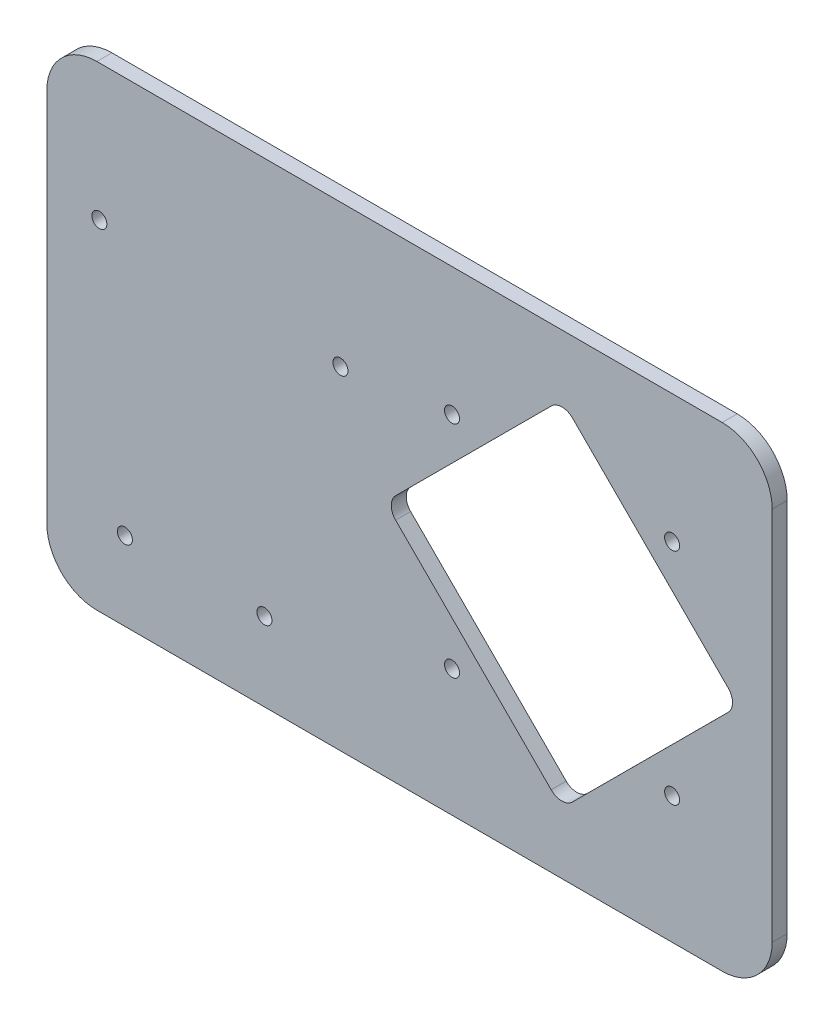
from build123d import *

# Parameters (mm, degrees)
SKETCH_1_R      = 1.5
EXTRUDE_1_DEPTH = 3


with BuildPart() as part:
    # 草图1 → 凸台-拉伸1 (new body)
    with BuildSketch(Plane(origin=(0, 0, 0), x_dir=(-1, 0, 0), z_dir=(0, 0, -1))):
        with BuildLine():
            Line((-108.521309774, 0), (16.478690226, 0))
            ThreePointArc((16.478690226, 0), (23.549758037, 2.928932188), (26.478690226, 10))
            Line((26.478690226, 10), (26.478690226, 84.99928))
            ThreePointArc((26.478690226, 84.99928), (23.549758037, 92.070347812), (16.478690226, 94.99928))
            Line((16.478690226, 94.99928), (-108.521309774, 94.99928))
            ThreePointArc((-108.521309774, 94.99928), (-115.592377586, 92.070347812), (-118.521309774, 84.99928))
            Line((-118.521309774, 84.99928), (-118.521309774, 10))
            ThreePointArc((-118.521309774, 10), (-115.592377586, 2.928932188), (-108.521309774, 0))
        make_face()
        with Locations(Location((15.978690226, 67.81454533, 0), (0, 0, 180))):
            Circle(SKETCH_1_R, mode=Mode.SUBTRACT)
        with Locations(Location((-32.220309774, 66.51524533, 0), (0, 0, 180))):
            Circle(SKETCH_1_R, mode=Mode.SUBTRACT)
        with Locations(Location((10.878690226, 15.71504533, 0), (0, 0, 180))):
            Circle(SKETCH_1_R, mode=Mode.SUBTRACT)
        with Locations(Location((-54.521309774, 69.37594533, 0), (0, 0, 180))):
            Circle(SKETCH_1_R, mode=Mode.SUBTRACT)
        with Locations(Location((-98.520309774, 69.37594533, 0), (0, 0, 180))):
            Circle(SKETCH_1_R, mode=Mode.SUBTRACT)
        with Locations(Location((-98.520309774, 25.37514533, 0), (0, 0, 180))):
            Circle(SKETCH_1_R, mode=Mode.SUBTRACT)
        with Locations(Location((-54.521309774, 25.37514533, 0), (0, 0, 180))):
            Circle(SKETCH_1_R, mode=Mode.SUBTRACT)
        with Locations(Location((-17.021309774, 15.71504533, 0), (0, 0, 180))):
            Circle(SKETCH_1_R, mode=Mode.SUBTRACT)
        with BuildLine():
            Line((-109.719554185, 49.655521805), (-78.625612362, 80.786563559))
            ThreePointArc((-78.625612362, 80.786563559), (-76.504816284, 81.666507838), (-74.382972429, 80.789093116))
            Line((-74.382972429, 80.789093116), (-43.251668672, 49.694889603))
            ThreePointArc((-43.251668672, 49.694889603), (-42.371724394, 47.574093524), (-43.249139115, 45.452249669))
            Line((-43.249139115, 45.452249669), (-74.343080939, 14.321207916))
            ThreePointArc((-74.343080939, 14.321207916), (-76.463877017, 13.441263637), (-78.585720872, 14.318678358))
            Line((-78.585720872, 14.318678358), (-109.717024628, 45.412881872))
            ThreePointArc((-109.717024628, 45.412881872), (-110.596968907, 47.53367795), (-109.719554185, 49.655521805))
        make_face(mode=Mode.SUBTRACT)
    extrude(amount=-EXTRUDE_1_DEPTH)


solid = part.part
